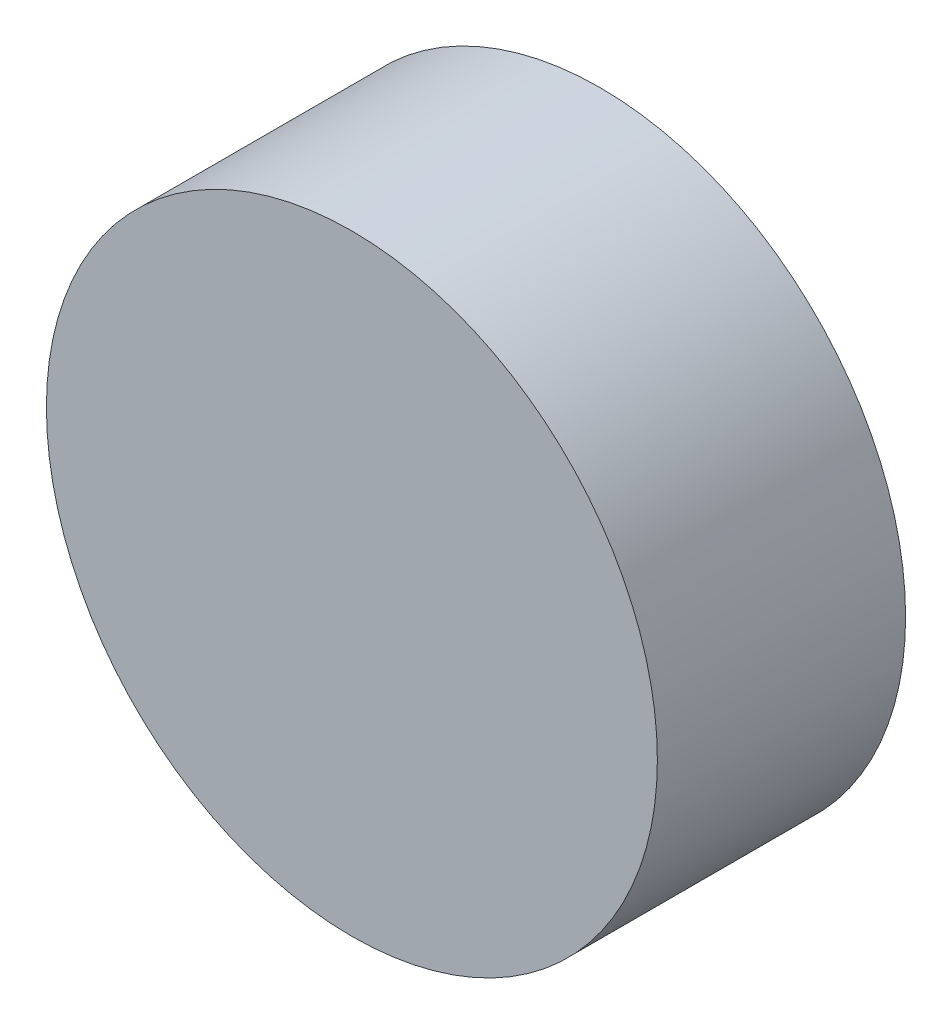
from build123d import *

# Parameters (mm, degrees)
SKETCH_1_R      = 4
EXTRUDE_1_DEPTH = 3.25


with BuildPart() as part:
    # 草图1 → 凸台-拉伸1 (new body)
    with BuildSketch(Plane.XY):
        with Locations(Location((-8.412089723, 9.413528976, 0), (0, 0, 180))):
            Circle(SKETCH_1_R)
    extrude(amount=EXTRUDE_1_DEPTH)


solid = part.part
